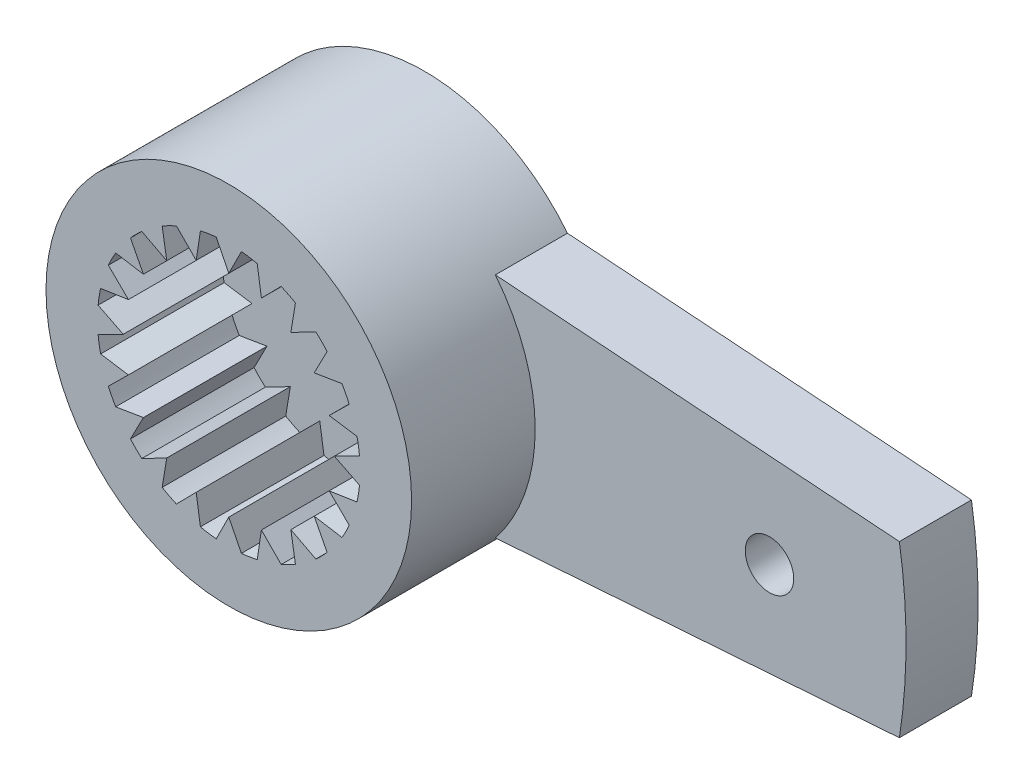
from build123d import *

# Parameters (mm, degrees)
BOSS_EXTRUDE2_DEPTH = 1.4
SKETCH6_R           = 0.47083328
CUT_EXTRUDE1_DEPTH  = 12.066142252
SKETCH8_R           = 3.549999952
BOSS_EXTRUDE3_DEPTH = 3.8
CUT_EXTRUDE2_START  = -2.4
SKETCH9_R           = 2.549999919
CUT_EXTRUDE2_DEPTH  = 2.4
BOSS_EXTRUDE4_START = -2.4
BOSS_EXTRUDE4_DEPTH = 2.4


with BuildPart() as part:
    # Sketch5 → Boss-Extrude2 (new body)
    with BuildSketch(Plane.XY.offset(-2.4)):
        with BuildLine():
            Line((2.776387215, 2.212277889), (10.622617722, 1.649999976))
            ThreePointArc((10.622617722, 1.649999976), (10.75199195, 0), (10.622617722, -1.649999976))
            Line((10.622617722, -1.649999976), (2.776387215, -2.212277889))
            ThreePointArc((2.776387215, -2.212277889), (3.549999952, 0), (2.776387215, 2.212277889))
        make_face()
    extrude(amount=-BOSS_EXTRUDE2_DEPTH)

    # Sketch6 → Cut-Extrude1 (cut, through all)
    with BuildSketch(Plane.XY.offset(-2.4)):
        with Locations((8.100000381, 0)):
            Circle(SKETCH6_R)
    extrude(amount=-CUT_EXTRUDE1_DEPTH, mode=Mode.SUBTRACT)

    # Sketch8 → Boss-Extrude3 (add)
    with BuildSketch(Plane.XY):
        Circle(SKETCH8_R)
    extrude(amount=-BOSS_EXTRUDE3_DEPTH)

    # Sketch9 → Cut-Extrude2 (cut)
    with BuildSketch(Plane.XY.offset(CUT_EXTRUDE2_START)):
        Circle(SKETCH9_R)
    extrude(amount=CUT_EXTRUDE2_DEPTH, mode=Mode.SUBTRACT)

    # Sketch7 → Boss-Extrude4 (add)
    with BuildSketch(Plane.XY.offset(BOSS_EXTRUDE4_START)):
        with BuildLine():
            Line((-0.244697916, 2.538232164), (0, 2.049999952))
            Line((0, 2.049999952), (0.244697916, 2.538232164))
            ThreePointArc((0.244697916, 2.538232164), (0, 2.549999919), (-0.244697916, 2.538232164))
        make_face()
        with BuildLine():
            Line((0.551635326, 2.489618054), (0.633484824, 1.949665813))
            Line((0.633484824, 1.949665813), (1.017078422, 2.338386424))
            ThreePointArc((1.017078422, 2.338386424), (0.787993311, 2.42519404), (0.551635326, 2.489618054))
        make_face()
        with BuildLine():
            Line((1.29397066, 2.197302783), (1.204959739, 1.6584848))
            Line((1.204959739, 1.6584848), (1.689900206, 1.90964313))
            ThreePointArc((1.689900206, 1.90964313), (1.498852346, 2.06299327), (1.29397066, 2.197302783))
        make_face()
        with BuildLine():
            Line((1.90964313, 1.689900206), (1.6584848, 1.204959739))
            Line((1.6584848, 1.204959739), (2.197302783, 1.29397066))
            ThreePointArc((2.197302783, 1.29397066), (2.06299327, 1.498852346), (1.90964313, 1.689900206))
        make_face()
        with BuildLine():
            Line((2.338386424, 1.017078422), (1.949665813, 0.633484824))
            Line((1.949665813, 0.633484824), (2.489618054, 0.551635326))
            ThreePointArc((2.489618054, 0.551635326), (2.42519404, 0.787993311), (2.338386424, 1.017078422))
        make_face()
        with BuildLine():
            Line((2.538232164, 0.244697916), (2.049999952, 0))
            Line((2.049999952, 0), (2.538232164, -0.244697916))
            ThreePointArc((2.538232164, -0.244697916), (2.549999919, 0), (2.538232164, 0.244697916))
        make_face()
        with BuildLine():
            Line((2.489618054, -0.551635326), (1.949665813, -0.633484824))
            Line((1.949665813, -0.633484824), (2.338386424, -1.017078422))
            ThreePointArc((2.338386424, -1.017078422), (2.42519404, -0.787993311), (2.489618054, -0.551635326))
        make_face()
        with BuildLine():
            Line((2.197302783, -1.29397066), (1.6584848, -1.204959739))
            Line((1.6584848, -1.204959739), (1.90964313, -1.689900206))
            ThreePointArc((1.90964313, -1.689900206), (2.06299327, -1.498852346), (2.197302783, -1.29397066))
        make_face()
        with BuildLine():
            Line((1.689900206, -1.90964313), (1.204959739, -1.6584848))
            Line((1.204959739, -1.6584848), (1.29397066, -2.197302783))
            ThreePointArc((1.29397066, -2.197302783), (1.498852346, -2.06299327), (1.689900206, -1.90964313))
        make_face()
        with BuildLine():
            Line((1.017078422, -2.338386424), (0.633484824, -1.949665813))
            Line((0.633484824, -1.949665813), (0.551635326, -2.489618054))
            ThreePointArc((0.551635326, -2.489618054), (0.787993311, -2.42519404), (1.017078422, -2.338386424))
        make_face()
        with BuildLine():
            Line((0.244697916, -2.538232164), (0, -2.049999952))
            Line((0, -2.049999952), (-0.244697916, -2.538232164))
            ThreePointArc((-0.244697916, -2.538232164), (0, -2.549999919), (0.244697916, -2.538232164))
        make_face()
        with BuildLine():
            Line((-0.551635326, -2.489618054), (-0.633484824, -1.949665813))
            Line((-0.633484824, -1.949665813), (-1.017078422, -2.338386424))
            ThreePointArc((-1.017078422, -2.338386424), (-0.787993311, -2.42519404), (-0.551635326, -2.489618054))
        make_face()
        with BuildLine():
            Line((-1.29397066, -2.197302783), (-1.204959739, -1.6584848))
            Line((-1.204959739, -1.6584848), (-1.689900206, -1.90964313))
            ThreePointArc((-1.689900206, -1.90964313), (-1.498852346, -2.06299327), (-1.29397066, -2.197302783))
        make_face()
        with BuildLine():
            Line((-1.90964313, -1.689900206), (-1.6584848, -1.204959739))
            Line((-1.6584848, -1.204959739), (-2.197302783, -1.29397066))
            ThreePointArc((-2.197302783, -1.29397066), (-2.06299327, -1.498852346), (-1.90964313, -1.689900206))
        make_face()
        with BuildLine():
            Line((-2.338386424, -1.017078422), (-1.949665813, -0.633484824))
            Line((-1.949665813, -0.633484824), (-2.489618054, -0.551635326))
            ThreePointArc((-2.489618054, -0.551635326), (-2.42519404, -0.787993311), (-2.338386424, -1.017078422))
        make_face()
        with BuildLine():
            Line((-2.538232164, -0.244697916), (-2.049999952, 0))
            Line((-2.049999952, 0), (-2.538232164, 0.244697916))
            ThreePointArc((-2.538232164, 0.244697916), (-2.549999919, 0), (-2.538232164, -0.244697916))
        make_face()
        with BuildLine():
            Line((-2.489618054, 0.551635326), (-1.949665813, 0.633484824))
            Line((-1.949665813, 0.633484824), (-2.338386424, 1.017078422))
            ThreePointArc((-2.338386424, 1.017078422), (-2.42519404, 0.787993311), (-2.489618054, 0.551635326))
        make_face()
        with BuildLine():
            Line((-2.197302783, 1.29397066), (-1.6584848, 1.204959739))
            Line((-1.6584848, 1.204959739), (-1.90964313, 1.689900206))
            ThreePointArc((-1.90964313, 1.689900206), (-2.06299327, 1.498852346), (-2.197302783, 1.29397066))
        make_face()
        with BuildLine():
            Line((-1.689900206, 1.90964313), (-1.204959739, 1.6584848))
            Line((-1.204959739, 1.6584848), (-1.29397066, 2.197302783))
            ThreePointArc((-1.29397066, 2.197302783), (-1.498852346, 2.06299327), (-1.689900206, 1.90964313))
        make_face()
        with BuildLine():
            Line((-1.017078422, 2.338386424), (-0.633484824, 1.949665813))
            Line((-0.633484824, 1.949665813), (-0.551635326, 2.489618054))
            ThreePointArc((-0.551635326, 2.489618054), (-0.787993311, 2.42519404), (-1.017078422, 2.338386424))
        make_face()
    extrude(amount=BOSS_EXTRUDE4_DEPTH)


solid = part.part
